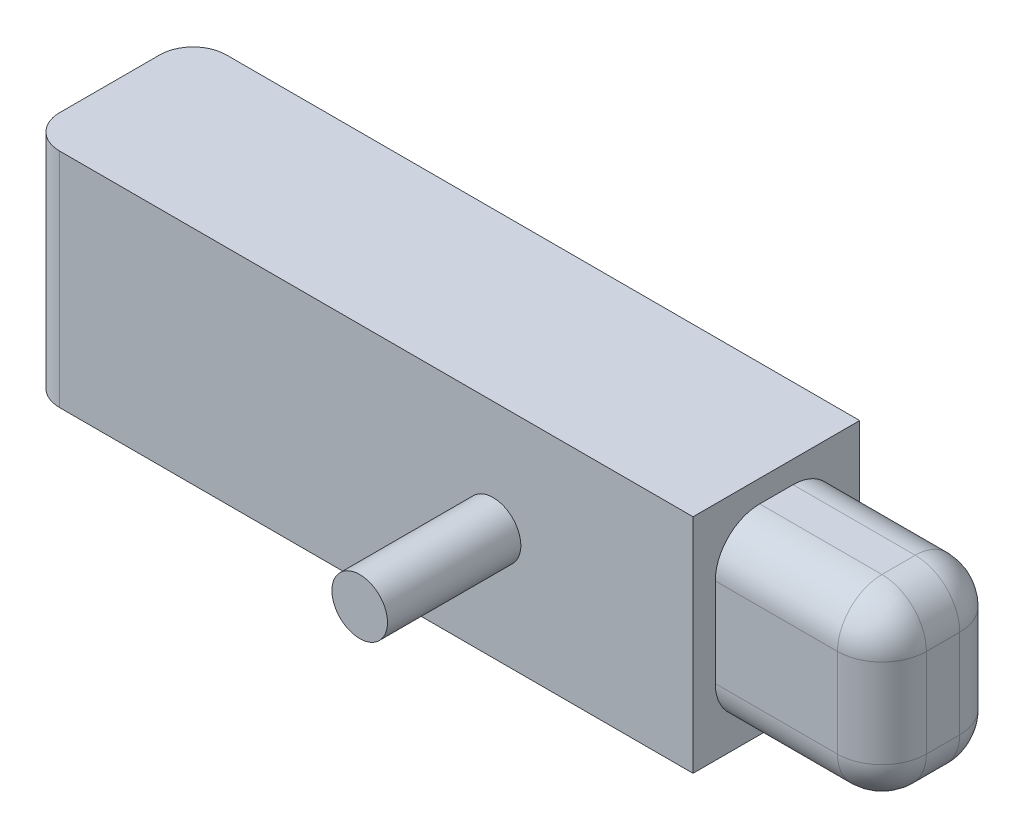
from build123d import *

# Parameters (mm, degrees)
CROQUIS1_W              = 60
CROQUIS1_H              = 15
SALIENTE_EXTRUIR1_DEPTH = 20
CROQUIS2_R              = 2.5
SALIENTE_EXTRUIR2_DEPTH = 12
CROQUIS3_W              = 11
CROQUIS3_H              = 16
SALIENTE_EXTRUIR3_DEPTH = 15
REDONDEO1_R             = 4
REDONDEO2_R             = 4
REDONDEO3_R             = 3
ESCALA1_SCALE           = 2


with BuildPart() as part:
    # Croquis1 → Saliente-Extruir1 (new body)
    with BuildSketch(Plane(origin=(0, 0, 0), x_dir=(1, 0, 0), z_dir=(0, 1, 0))):
        Rectangle(CROQUIS1_W, CROQUIS1_H)
    extrude(amount=SALIENTE_EXTRUIR1_DEPTH)

    # Croquis2 → Saliente-Extruir2 (add)
    with BuildSketch(Plane.XY.offset(7.5)):
        with Locations(Location((12, 10, 0), (0, 0, 180))):
            Circle(CROQUIS2_R)
    extrude(amount=SALIENTE_EXTRUIR2_DEPTH)

    # Croquis3 → Saliente-Extruir3 (add)
    with BuildSketch(Plane(origin=(30, 0, 0), x_dir=(0, 0, -1), z_dir=(1, 0, 0))):
        with Locations((0, 10)):
            Rectangle(CROQUIS3_W, CROQUIS3_H)
    extrude(amount=SALIENTE_EXTRUIR3_DEPTH)

    # Redondeo1
    redondeo1_edges = [part.edges().sort_by_distance(p)[0] for p in [
        (37.5, 18, 5.5),
        (37.5, 2, 5.5),
        (37.5, 2, -5.5),
        (37.5, 18, -5.5),
    ]]
    fillet(redondeo1_edges, radius=REDONDEO1_R)

    # Redondeo2
    redondeo2_edges = [part.edges().sort_by_distance(p)[0] for p in [
        (45, 18, 0),
        (45, 10, -5.5),
        (45, 10, 5.5),
        (45, 2, 0),
        (45, 16.828427125, 4.328427125),
        (45, 3.171572875, 4.328427125),
        (45, 3.171572875, -4.328427125),
        (45, 16.828427125, -4.328427125),
    ]]
    fillet(redondeo2_edges, radius=REDONDEO2_R)

    # Redondeo3
    redondeo3_edges = [part.edges().sort_by_distance(p)[0] for p in [
        (-30, 10, -7.5),
        (-30, 10, 7.5),
    ]]
    fillet(redondeo3_edges, radius=REDONDEO3_R)


with BuildPart() as part_1:
    # Escala1: scaled about (4.405278124, 10, 0.15554504)
    add(part.part.scale(ESCALA1_SCALE).moved(Location((-4.405278124, -10, -0.15554504))))


solid = part_1.part
